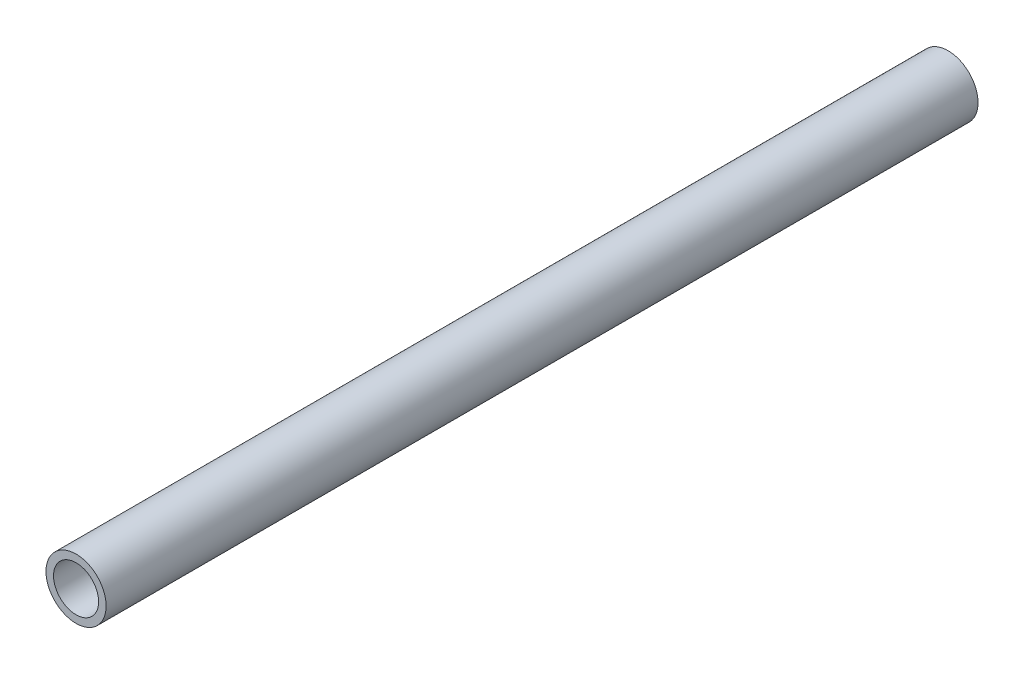
from build123d import *

# Parameters (mm, degrees)
SKETCH_1_R      = 2
SKETCH_1_R_2    = 1.5
EXTRUDE_1_DEPTH = 29


with BuildPart() as part:
    # 草图1 → 凸台-拉伸1 (new, symmetric)
    with BuildSketch(Plane.XY):
        with Locations(Location((0, 0, 0), (0, 0, 180))):
            Circle(SKETCH_1_R)
        with Locations(Location((0, 0, 0), (0, 0, 180))):
            Circle(SKETCH_1_R_2, mode=Mode.SUBTRACT)
    extrude(amount=EXTRUDE_1_DEPTH, both=True)


solid = part.part
